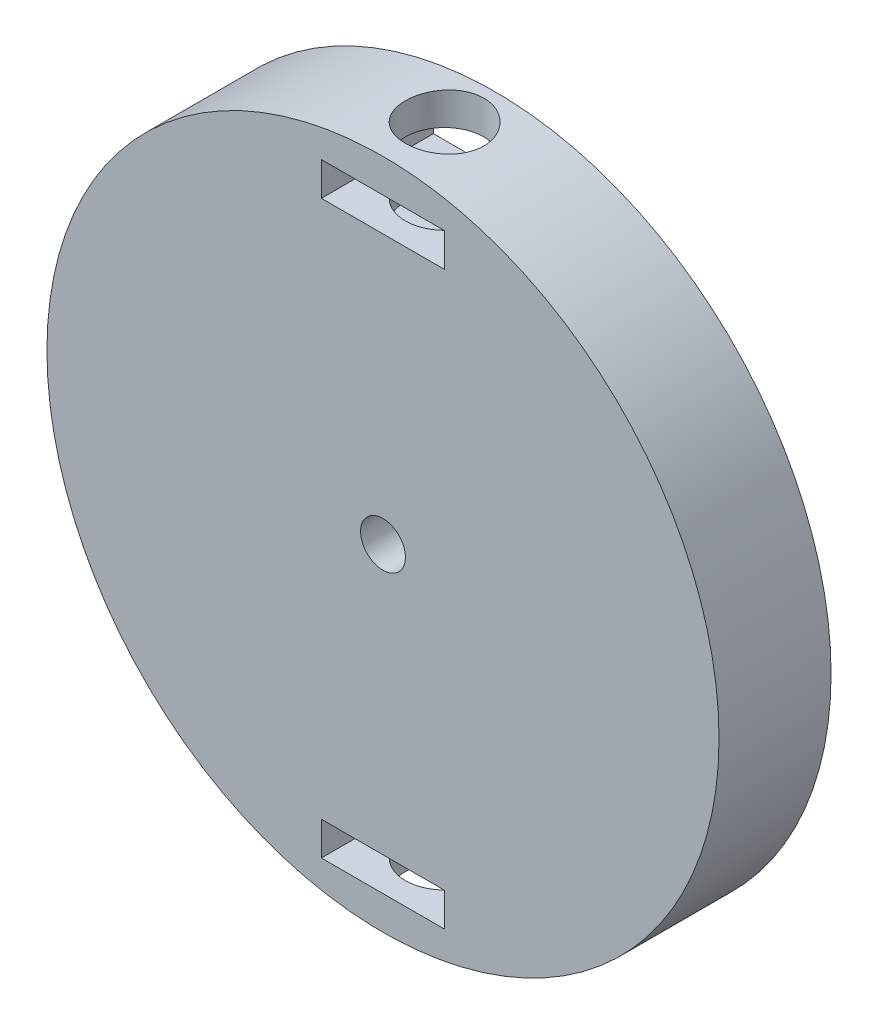
from build123d import *

# Parameters (mm, degrees)
SKETCH1_R           = 30
BOSS_EXTRUDE1_DEPTH = 10
SKETCH10_R          = 3.5
CUT_EXTRUDE6_DEPTH  = 8
SKETCH23_W          = 11
SKETCH23_H          = 3
CUT_EXTRUDE8_DEPTH  = 10
SKETCH24_R          = 2
CUT_EXTRUDE9_DEPTH  = 10


with BuildPart() as part:
    # Sketch1 → Boss-Extrude1 (new body)
    with BuildSketch(Plane.XY):
        Circle(SKETCH1_R)
    extrude(amount=BOSS_EXTRUDE1_DEPTH)

    # Sketch10 → Cut-Extrude6 (cut)
    with BuildSketch(Plane(origin=(0, -30, 0), x_dir=(-1, 0, 0), z_dir=(0, -1, 0))):
        with Locations(Location((0, -4.5, 0), (0, 0, 90))):
            Circle(SKETCH10_R)
    cut_extrude6 = extrude(amount=-CUT_EXTRUDE6_DEPTH, mode=Mode.SUBTRACT)

    # Mirror2: Cut-Extrude6 across plane
    add(cut_extrude6.mirror(Plane.ZX), mode=Mode.SUBTRACT)

    # Sketch23 → Cut-Extrude8 (cut)
    with BuildSketch(Plane(origin=(0, 0, 0), x_dir=(-1, 0, 0), z_dir=(0, 0, -1))):
        with Locations((0, 25.5)):
            Rectangle(SKETCH23_W, SKETCH23_H)
    cut_extrude8 = extrude(amount=-CUT_EXTRUDE8_DEPTH, mode=Mode.SUBTRACT)

    # Mirror3: Cut-Extrude8 across plane
    add(cut_extrude8.mirror(Plane.ZX), mode=Mode.SUBTRACT)

    # Sketch24 → Cut-Extrude9 (cut)
    with BuildSketch(Plane(origin=(0, 0, 0), x_dir=(-1, 0, 0), z_dir=(0, 0, -1))):
        Circle(SKETCH24_R)
    extrude(amount=-CUT_EXTRUDE9_DEPTH, mode=Mode.SUBTRACT)


solid = part.part
